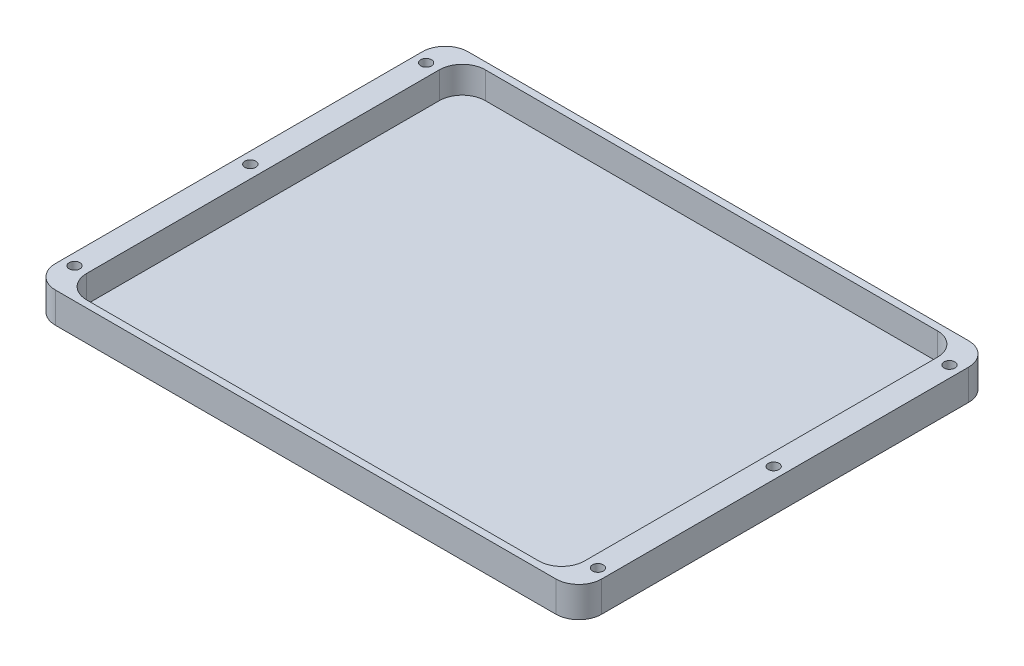
from build123d import *

# Parameters (mm, degrees)
SKETCH1_W                                         = 226.949
SKETCH1_H                                         = 171.45
BOSS_EXTRUDE1_DEPTH                               = 12.7
CUT_EXTRUDE1_DEPTH                                = 11.1125
CSK_FOR_8_FLAT_HEAD_SOCKET_CAP_SCREW1_D           = 4.4958
CSK_FOR_8_FLAT_HEAD_SOCKET_CAP_SCREW1_CSINK_D     = 9.1186
CSK_FOR_8_FLAT_HEAD_SOCKET_CAP_SCREW1_CSINK_ANGLE = 82
FILLET1_R                                         = 9.525


with BuildPart() as part:
    # Sketch1 → Boss-Extrude1 (new body)
    with BuildSketch(Plane(origin=(0, 0, 0), x_dir=(1, 0, 0), z_dir=(0, 1, 0))):
        with Locations((113.4745, 85.725)):
            Rectangle(SKETCH1_W, SKETCH1_H)
    extrude(amount=BOSS_EXTRUDE1_DEPTH)

    # Sketch2 → Cut-Extrude1 (cut)
    with BuildSketch(Plane(origin=(0, 12.7, 0), x_dir=(1, 0, 0), z_dir=(0, 1, 0))):
        with BuildLine():
            Line((19.558, 2.921), (207.391, 2.921))
            ThreePointArc((207.391, 2.921), (214.126192091, 5.710807909), (216.916, 12.446))
            Line((216.916, 12.446), (216.916, 159.004))
            ThreePointArc((216.916, 159.004), (214.126192091, 165.739192091), (207.391, 168.529))
            Line((207.391, 168.529), (19.558, 168.529))
            ThreePointArc((19.558, 168.529), (12.822807909, 165.739192091), (10.033, 159.004))
            Line((10.033, 159.004), (10.033, 12.446))
            ThreePointArc((10.033, 12.446), (12.822807909, 5.710807909), (19.558, 2.921))
        make_face()
    extrude(amount=-CUT_EXTRUDE1_DEPTH, mode=Mode.SUBTRACT)

    # CSK for #8 Flat Head Socket Cap Screw1 (through all)
    with Locations(Plane.XZ):
        with Locations((4.7625, -12.7), (4.7625, -158.75), (4.7625, -85.725)):
            csk_for_8_flat_head_socket_cap_screw1 = CounterSinkHole(CSK_FOR_8_FLAT_HEAD_SOCKET_CAP_SCREW1_D / 2, CSK_FOR_8_FLAT_HEAD_SOCKET_CAP_SCREW1_CSINK_D / 2, counter_sink_angle=CSK_FOR_8_FLAT_HEAD_SOCKET_CAP_SCREW1_CSINK_ANGLE)

    # Mirror1: CSK for #8 Flat Head Socket Cap Screw1 across plane
    add(csk_for_8_flat_head_socket_cap_screw1.mirror(Plane(origin=(113.4745, 0, 0), x_dir=(0, 0, 1), z_dir=(1, 0, 0))), mode=Mode.SUBTRACT)

    # Fillet1
    fillet1_edges = [part.edges().sort_by_distance(p)[0] for p in [
        (0, 6.35, -171.45),
        (226.949, 6.35, -171.45),
        (226.949, 6.35, 0),
        (0, 6.35, 0),
    ]]
    fillet(fillet1_edges, radius=FILLET1_R)


solid = part.part
